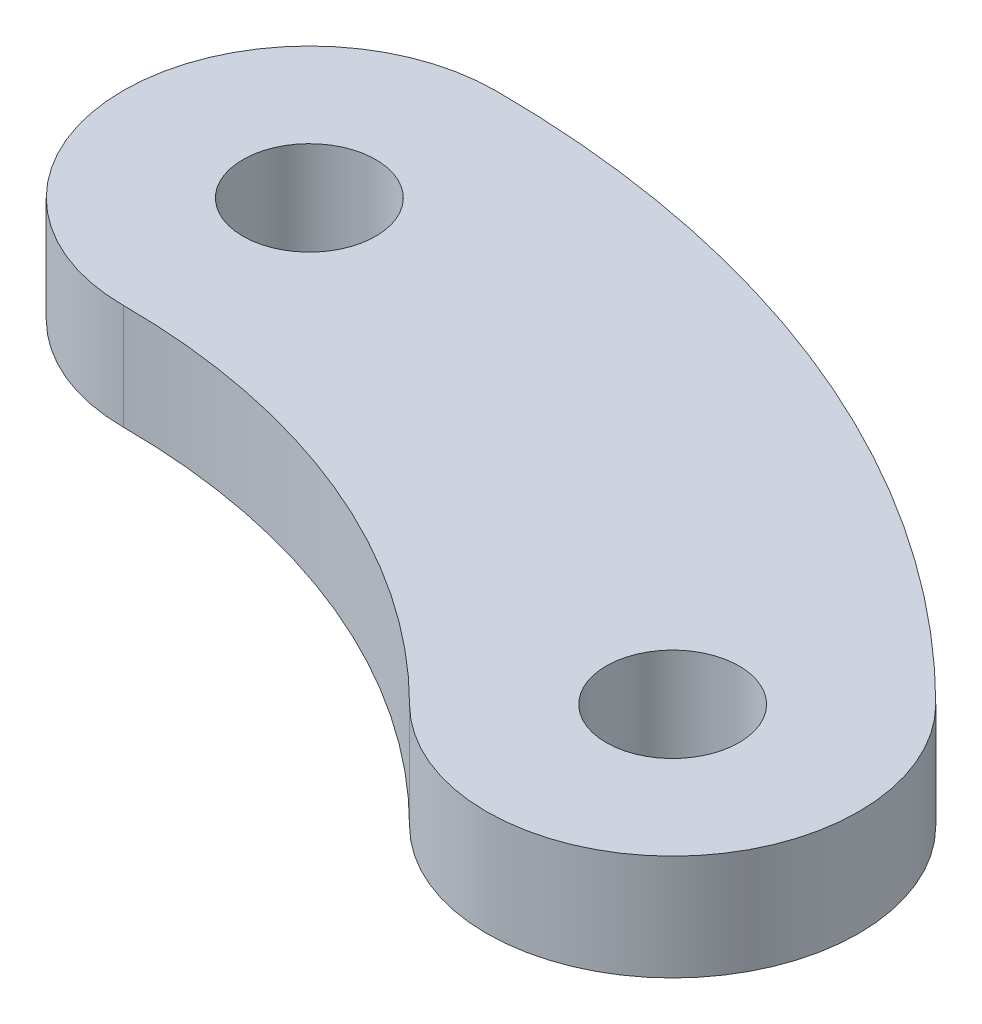
from build123d import *

# Parameters (mm, degrees)
SKETCH1_R           = 5
BOSS_EXTRUDE1_DEPTH = 7.9375


with BuildPart() as part:
    # Sketch1 → Boss-Extrude1 (new body)
    with BuildSketch(Plane(origin=(0, 0, 0), x_dir=(1, 0, 0), z_dir=(0, 1, 0))):
        with BuildLine():
            ThreePointArc((56.568542495, 56.568542495), (30.614674589, 73.910362601), (0, 80))
            ThreePointArc((0, 80), (-14, 66), (0, 52))
            ThreePointArc((0, 52), (19.899538483, 48.041735691), (36.769552622, 36.769552622))
            ThreePointArc((36.769552622, 36.769552622), (56.568542495, 36.769552622), (56.568542495, 56.568542495))
        make_face()
        with Locations(Location((0, 66, 0), (0, 0, 270))):
            Circle(SKETCH1_R, mode=Mode.SUBTRACT)
        with Locations(Location((46.669047558, 46.669047558, 0), (0, 0, 270))):
            Circle(SKETCH1_R, mode=Mode.SUBTRACT)
    extrude(amount=BOSS_EXTRUDE1_DEPTH)


solid = part.part
